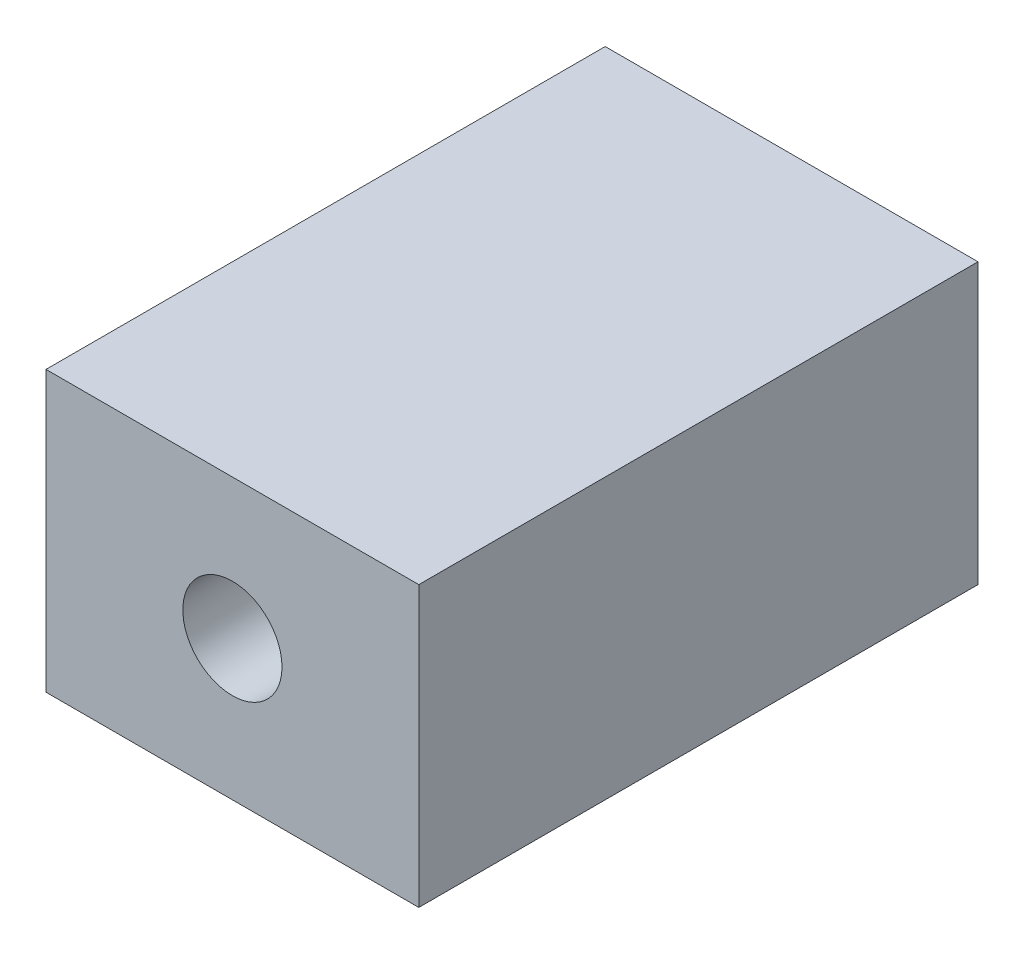
from build123d import *

# Parameters (mm, degrees)
SKETCH1_W                 = 25.4
SKETCH1_H                 = 38.1
BOSS_EXTRUDE1_DEPTH       = 9.525
F_1_4_CLEARANCE_HOLE1_D   = 6.7564
F_8_32_TAPPED_HOLE1_D     = 3.4544
F_8_32_TAPPED_HOLE1_DEPTH = 10.668
F_8_32_TAPPED_HOLE1_TIP   = 1.037806461


with BuildPart() as part:
    # Sketch1 → Boss-Extrude1 (new, symmetric)
    with BuildSketch(Plane(origin=(0, 0, 0), x_dir=(1, 0, 0), z_dir=(0, 1, 0))):
        Rectangle(SKETCH1_W, SKETCH1_H)
    extrude(amount=BOSS_EXTRUDE1_DEPTH, both=True)

    # 1/4 Clearance Hole1 (through all)
    with Locations(Plane.XY.offset(19.05)):
        with Locations((0, 0)):
            Hole(F_1_4_CLEARANCE_HOLE1_D / 2)

    # #8-32 Tapped Hole1
    with Locations(Plane(origin=(0, -9.525, 0), x_dir=(-1, 0, 0), z_dir=(0, -1, 0))):
        with Locations((8.89, -12.7), (-8.89, 12.7)):
            Hole(F_8_32_TAPPED_HOLE1_D / 2, depth=F_8_32_TAPPED_HOLE1_DEPTH)
            with Locations((0, 0, -(F_8_32_TAPPED_HOLE1_DEPTH + F_8_32_TAPPED_HOLE1_TIP / 2))):  # 118° drill point
                Cone(0, F_8_32_TAPPED_HOLE1_D / 2, F_8_32_TAPPED_HOLE1_TIP, mode=Mode.SUBTRACT)


solid = part.part
